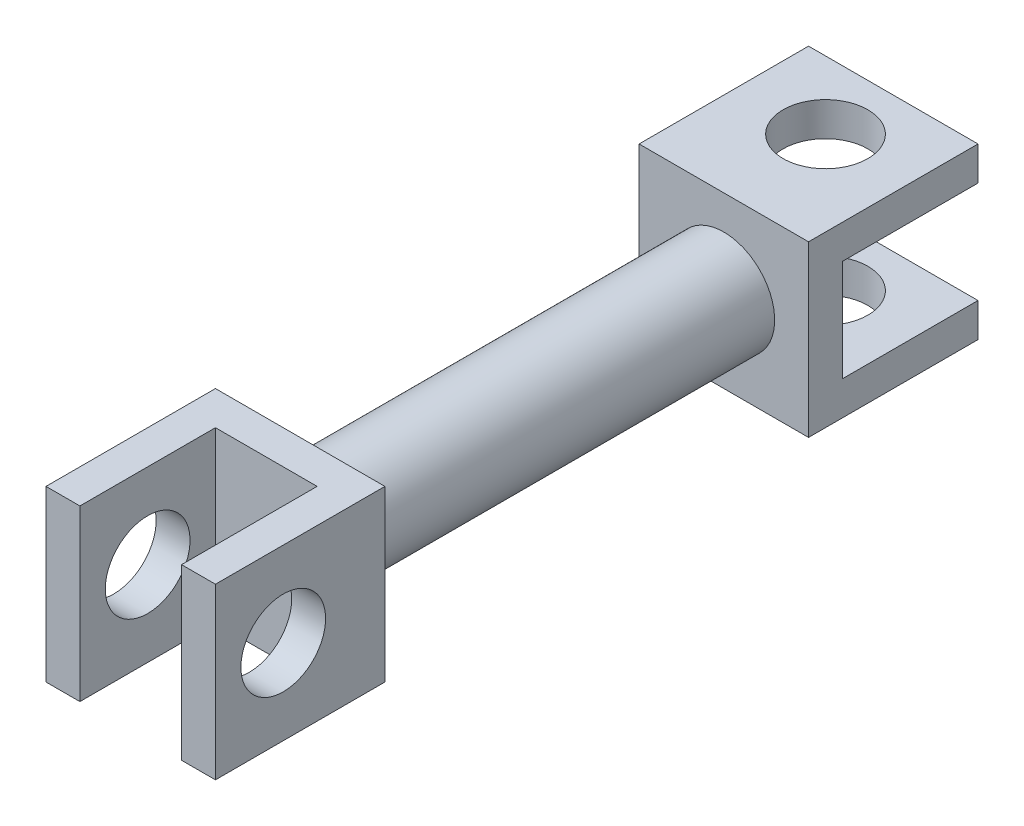
from build123d import *

# Parameters (mm, degrees)
SKETCH1_W           = 10
SKETCH1_H           = 10
BOSS_EXTRUDE1_DEPTH = 2
SKETCH2_W           = 2
SKETCH2_H           = 10
BOSS_EXTRUDE2_DEPTH = 8
SKETCH3_R           = 2.5
CUT_EXTRUDE1_DEPTH  = 16
SKETCH4_R           = 3
BOSS_EXTRUDE3_DEPTH = 25
SKETCH5_W           = 10
SKETCH5_H           = 10
BOSS_EXTRUDE4_DEPTH = 2
SKETCH6_W           = 10
SKETCH6_H           = 2
BOSS_EXTRUDE5_DEPTH = 8
SKETCH7_R           = 2.5
CUT_EXTRUDE2_DEPTH  = 37.742346142


with BuildPart() as part:
    # Sketch1 → Boss-Extrude1 (new body)
    with BuildSketch(Plane.XY):
        Rectangle(SKETCH1_W, SKETCH1_H)
    extrude(amount=BOSS_EXTRUDE1_DEPTH)

    # Sketch2 → Boss-Extrude2 (add)
    with BuildSketch(Plane.XY.offset(2)):
        with Locations((-4, 0)):
            Rectangle(SKETCH2_W, SKETCH2_H)
        with Locations((4, 0)):
            Rectangle(SKETCH2_W, SKETCH2_H)
    extrude(amount=BOSS_EXTRUDE2_DEPTH)

    # Sketch3 → Cut-Extrude1 (cut, through all)
    with BuildSketch(Plane.ZY.offset(5)):
        with Locations(Location((6, 0, 0), (0, 0, 270))):
            Circle(SKETCH3_R)
    extrude(amount=-CUT_EXTRUDE1_DEPTH, mode=Mode.SUBTRACT)

    # Sketch4 → Boss-Extrude3 (add)
    with BuildSketch(Plane(origin=(0, 0, 0), x_dir=(-1, 0, 0), z_dir=(0, 0, -1))):
        Circle(SKETCH4_R)
    extrude(amount=BOSS_EXTRUDE3_DEPTH)

    # Sketch5 → Boss-Extrude4 (add)
    with BuildSketch(Plane(origin=(0, 0, -25), x_dir=(-1, 0, 0), z_dir=(0, 0, -1))):
        Rectangle(SKETCH5_W, SKETCH5_H)
    extrude(amount=BOSS_EXTRUDE4_DEPTH)

    # Sketch6 → Boss-Extrude5 (add)
    with BuildSketch(Plane(origin=(0, 0, -27), x_dir=(-1, 0, 0), z_dir=(0, 0, -1))):
        with Locations((0, -4)):
            Rectangle(SKETCH6_W, SKETCH6_H)
        with Locations((0, 4)):
            Rectangle(SKETCH6_W, SKETCH6_H)
    extrude(amount=BOSS_EXTRUDE5_DEPTH)

    # Sketch7 → Cut-Extrude2 (cut, through all)
    with BuildSketch(Plane.XZ.offset(5)):
        with Locations(Location((0, -31, 0), (0, 0, 270))):
            Circle(SKETCH7_R)
    extrude(amount=-CUT_EXTRUDE2_DEPTH, mode=Mode.SUBTRACT)


solid = part.part
